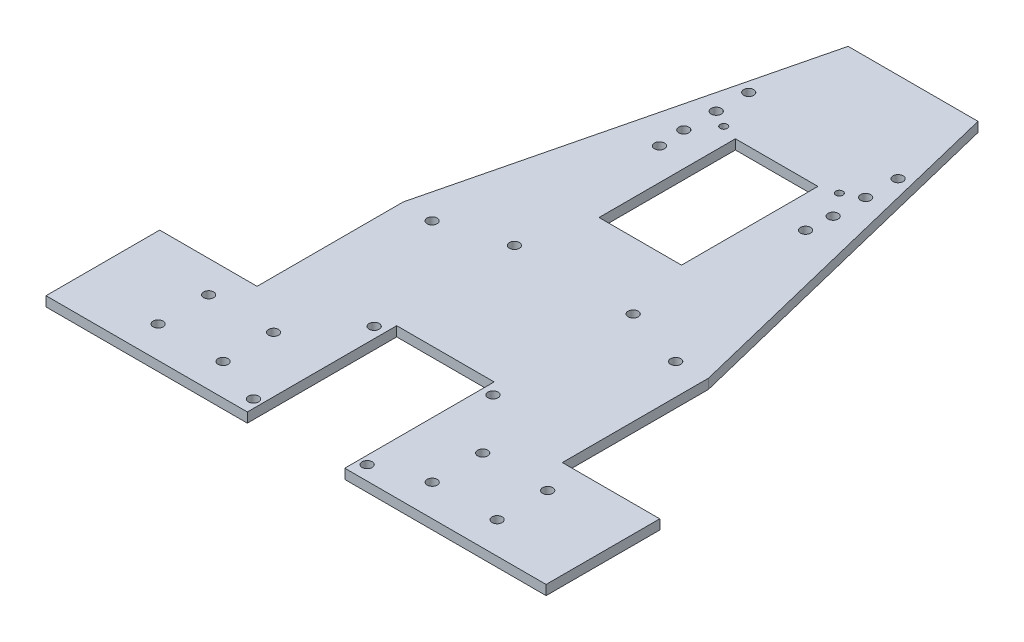
from build123d import *

# Parameters (mm, degrees)
BODY_DEPTH              = 3
SKETCH4_R               = 1.55
MOTOR_MOUNT_DEPTH       = 3
SKETCH5_R               = 1.1
SKETCH5_W               = 25.4
SKETCH5_H               = 42
PROTOBOARD_MOUNT_DEPTH  = 10
SKETCH8_R               = 1.55
STAND_OFF_MOUNT_DEPTH   = 10
SKETCH9_W               = 30
SKETCH9_H               = 35
BOSS_EXTRUDE1_DEPTH     = 3
SKETCH10_R              = 1.55
CUT_EXTRUDE1_DEPTH      = 164.321768298
SKETCH11_R              = 1.55
CASTER_BALL_MOUNT_DEPTH = 164.321768298


with BuildPart() as part:
    # Sketch3 → Body (new body)
    with BuildSketch(Plane(origin=(0, 0, 0), x_dir=(1, 0, 0), z_dir=(0, 1, 0))):
        Polygon((-15, -46), (-47, -46), (-47, 34), (-20, 144), (20, 144), (47, 34), (47, -46), (15, -46), (15, 0), (-15, 0), align=None)
    extrude(amount=BODY_DEPTH)

    # Sketch4 → Motor Mount (cut)
    with BuildSketch(Plane(origin=(0, 3, 0), x_dir=(1, 0, 0), z_dir=(0, 1, 0))):
        with Locations(Location((-18.29, -3.65, 0), (0, 0, 270))):
            Circle(SKETCH4_R)
        with Locations(Location((18.29, -3.65, 0), (0, 0, 90))):
            Circle(SKETCH4_R)
        with Locations(Location((-18.29, 39.53, 0), (0, 0, 270))):
            Circle(SKETCH4_R)
        with Locations(Location((18.29, 39.53, 0), (0, 0, 270))):
            Circle(SKETCH4_R)
    extrude(amount=-MOTOR_MOUNT_DEPTH, mode=Mode.SUBTRACT)

    # Sketch5 → Protoboard Mount (cut)
    with BuildSketch(Plane(origin=(0, 3, 0), x_dir=(1, 0, 0), z_dir=(0, 1, 0))):
        with Locations(Location((-17.8, 103.5, 0), (0, 0, 270))):
            Circle(SKETCH5_R)
        with Locations(Location((17.8, 103.5, 0), (0, 0, 270))):
            Circle(SKETCH5_R)
        with Locations((0, 81)):
            Rectangle(SKETCH5_W, SKETCH5_H)
    extrude(amount=-PROTOBOARD_MOUNT_DEPTH, mode=Mode.SUBTRACT)

    # Sketch8 → Stand Off Mount (cut)
    with BuildSketch(Plane(origin=(0, 3, 0), x_dir=(1, 0, 0), z_dir=(0, 1, 0))):
        with Locations(Location((-22.5, 88.4, 0), (0, 0, 270))):
            Circle(SKETCH8_R)
        with Locations(Location((22.5, 88.4, 0), (0, 0, 270))):
            Circle(SKETCH8_R)
        with Locations(Location((37.5, 33.4, 0), (0, 0, 270))):
            Circle(SKETCH8_R)
        with Locations(Location((-37.5, 33.4, 0), (0, 0, 270))):
            Circle(SKETCH8_R)
        with Locations(Location((-17.5, -41.6, 0), (0, 0, 270))):
            Circle(SKETCH8_R)
        with Locations(Location((17.5, -41.6, 0), (0, 0, 270))):
            Circle(SKETCH8_R)
    extrude(amount=-STAND_OFF_MOUNT_DEPTH, mode=Mode.SUBTRACT)

    # Sketch9 → Boss-Extrude1 (add)
    with BuildSketch(Plane(origin=(0, 3, 0), x_dir=(1, 0, 0), z_dir=(0, 1, 0))):
        with Locations((62, -28.5)):
            Rectangle(SKETCH9_W, SKETCH9_H)
        with Locations((-62, -28.5)):
            Rectangle(SKETCH9_W, SKETCH9_H)
    extrude(amount=-BOSS_EXTRUDE1_DEPTH)

    # Sketch10 → Cut-Extrude1 (cut, through all)
    with BuildSketch(Plane(origin=(0, 3, 0), x_dir=(1, 0, 0), z_dir=(0, 1, 0))):
        with Locations(Location((-52.2, -20.72, 0), (0, 0, 270))):
            Circle(SKETCH10_R)
        with Locations(Location((-32.2, -20.72, 0), (0, 0, 270))):
            Circle(SKETCH10_R)
        with Locations(Location((-52.2, -36.28, 0), (0, 0, 270))):
            Circle(SKETCH10_R)
        with Locations(Location((-32.2, -36.28, 0), (0, 0, 270))):
            Circle(SKETCH10_R)
        with Locations(Location((32.2, -36.28, 0), (0, 0, 90))):
            Circle(SKETCH10_R)
        with Locations(Location((52.2, -36.28, 0), (0, 0, 90))):
            Circle(SKETCH10_R)
        with Locations(Location((32.2, -20.72, 0), (0, 0, 90))):
            Circle(SKETCH10_R)
        with Locations(Location((52.2, -20.72, 0), (0, 0, 90))):
            Circle(SKETCH10_R)
    extrude(amount=-CUT_EXTRUDE1_DEPTH, mode=Mode.SUBTRACT)

    # Sketch11 → Caster Ball Mount (cut, through all)
    with BuildSketch(Plane(origin=(0, 3, 0), x_dir=(1, 0, 0), z_dir=(0, 1, 0))):
        with Locations(Location((-23, 96.4, 0), (0, 0, 270))):
            Circle(SKETCH11_R)
        with Locations(Location((-23, 106.4, 0), (0, 0, 270))):
            Circle(SKETCH11_R)
        with Locations(Location((-23, 116.4, 0), (0, 0, 270))):
            Circle(SKETCH11_R)
        with Locations(Location((23, 96.4, 0), (0, 0, 90))):
            Circle(SKETCH11_R)
        with Locations(Location((23, 106.4, 0), (0, 0, 90))):
            Circle(SKETCH11_R)
        with Locations(Location((23, 116.4, 0), (0, 0, 90))):
            Circle(SKETCH11_R)
    extrude(amount=-CASTER_BALL_MOUNT_DEPTH, mode=Mode.SUBTRACT)


solid = part.part
